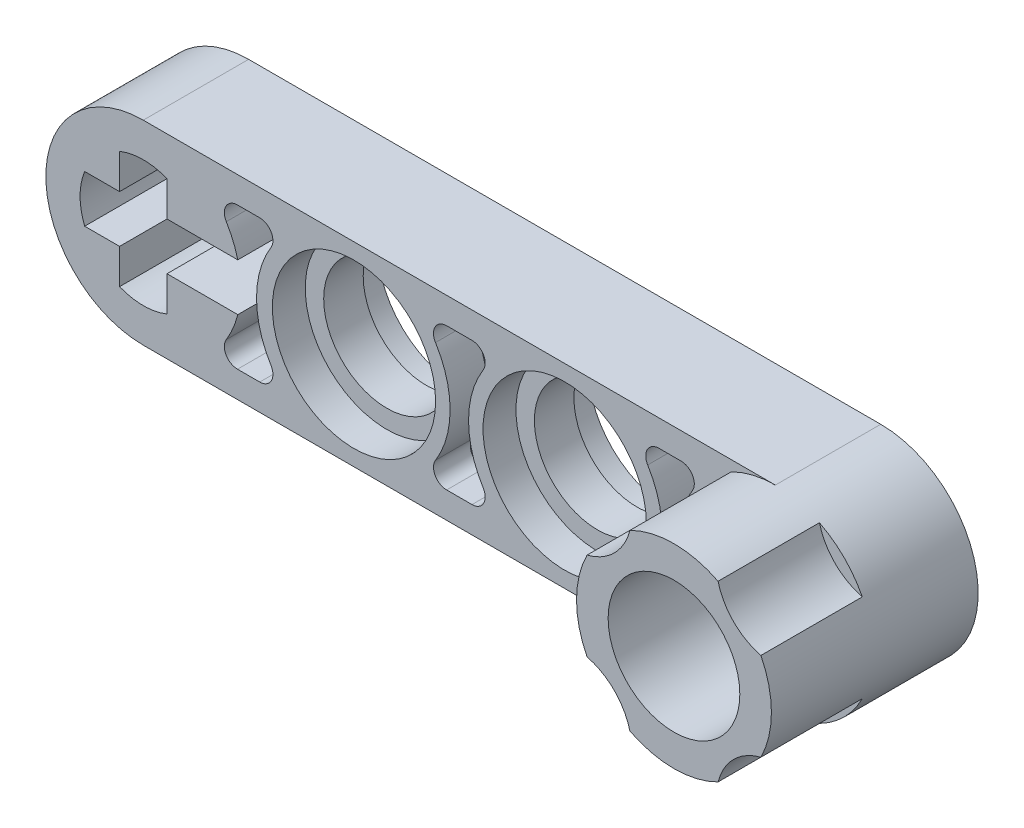
from build123d import *

# Parameters (mm, degrees)
SKETCH1_R            = 2.4
BEAM_DEPTH           = 2
AXLE_CUT_DEPTH       = 29.017494535
AXLE_CUT_DEPTH_BACK  = 29.017494535
SKETCH3_R            = 3.1
HOLE_SURROUND_DEPTH  = 1.25
CAVITY_CUT_DEPTH     = 1.4
FILLET2_R            = 0.5
FILLET2_OF_MIRROR2_R = 0.5
FILLET3_R            = 0.5
SKETCH5_R            = 2.5
EXTENSION_DEPTH      = 3.85


with BuildPart() as part:
    # Sketch1 → Beam (new, symmetric)
    with BuildSketch(Plane.XY):
        with BuildLine():
            Line((24, 3.7), (0, 3.7))
            ThreePointArc((0, 3.7), (-3.7, 0), (0, -3.7))
            Line((0, -3.7), (24, -3.7))
            ThreePointArc((24, -3.7), (27.7, 0), (24, 3.7))
        make_face()
        with Locations((8, 0)):
            Circle(SKETCH1_R, mode=Mode.SUBTRACT)
        with Locations((16, 0)):
            Circle(SKETCH1_R, mode=Mode.SUBTRACT)
    extrude(amount=BEAM_DEPTH, both=True)

    # Sketch2 → Axle Cut (cut, two sides: drawn at the far end of the back side and taken through both)
    with BuildSketch(Plane.XY.offset(-AXLE_CUT_DEPTH_BACK)):
        with BuildLine():
            ThreePointArc((-0.9, -2.224859546), (0, -2.4), (0.9, -2.224859546))
            Line((0.9, -2.224859546), (0.9, -0.9))
            Line((0.9, -0.9), (3.588871689, -0.9))
            ThreePointArc((3.588871689, -0.9), (3.188981578, -1.876271967), (2.529822128, -2.7))
            Line((2.529822128, -2.7), (5.470177872, -2.7))
            ThreePointArc((5.470177872, -2.7), (4.3, 0), (5.470177872, 2.7))
            Line((5.470177872, 2.7), (2.529822128, 2.7))
            ThreePointArc((2.529822128, 2.7), (3.188981578, 1.876271967), (3.588871689, 0.9))
            Line((3.588871689, 0.9), (0.9, 0.9))
            Line((0.9, 0.9), (0.9, 2.224859546))
            ThreePointArc((0.9, 2.224859546), (0, 2.4), (-0.9, 2.224859546))
            Line((-0.9, 2.224859546), (-0.9, 0.9))
            Line((-0.9, 0.9), (-2.224859546, 0.9))
            ThreePointArc((-2.224859546, 0.9), (-2.4, 0), (-2.224859546, -0.9))
            Line((-2.224859546, -0.9), (-0.9, -0.9))
            Line((-0.9, -0.9), (-0.9, -2.224859546))
        make_face()
        with BuildLine():
            Line((18.529822128, -2.7), (21.470177872, -2.7))
            ThreePointArc((21.470177872, -2.7), (20.811018422, -1.876271967), (20.411128311, -0.9))
            Line((20.411128311, -0.9), (23.1, -0.9))
            Line((23.1, -0.9), (23.1, -2.224859546))
            ThreePointArc((23.1, -2.224859546), (24, -2.4), (24.9, -2.224859546))
            Line((24.9, -2.224859546), (24.9, -0.9))
            Line((24.9, -0.9), (26.224859546, -0.9))
            ThreePointArc((26.224859546, -0.9), (26.4, 0), (26.224859546, 0.9))
            Line((26.224859546, 0.9), (24.9, 0.9))
            Line((24.9, 0.9), (24.9, 2.224859546))
            ThreePointArc((24.9, 2.224859546), (24, 2.4), (23.1, 2.224859546))
            Line((23.1, 2.224859546), (23.1, 0.9))
            Line((23.1, 0.9), (20.411128311, 0.9))
            ThreePointArc((20.411128311, 0.9), (20.811018422, 1.876271967), (21.470177872, 2.7))
            Line((21.470177872, 2.7), (18.529822128, 2.7))
            ThreePointArc((18.529822128, 2.7), (19.7, 0), (18.529822128, -2.7))
        make_face()
    extrude(amount=AXLE_CUT_DEPTH + AXLE_CUT_DEPTH_BACK, mode=Mode.SUBTRACT)

    # Sketch3 → Hole Surround (cut)
    with BuildSketch(Plane.XY.offset(2)):
        with Locations((16, 0)):
            Circle(SKETCH3_R)
        with Locations((8, 0)):
            Circle(SKETCH3_R)
    hole_surround = extrude(amount=-HOLE_SURROUND_DEPTH, mode=Mode.SUBTRACT)

    # Sketch4 → Cavity Cut (cut)
    with BuildSketch(Plane.XY.offset(2)):
        with BuildLine():
            Line((13.543885182, 2.7), (10.456114818, 2.7))
            ThreePointArc((10.456114818, 2.7), (11.338212028, 1.476089583), (11.65, 0))
            ThreePointArc((11.65, 0), (11.338212028, -1.476089583), (10.456114818, -2.7))
            Line((10.456114818, -2.7), (13.543885182, -2.7))
            ThreePointArc((13.543885182, -2.7), (12.35, 0), (13.543885182, 2.7))
        make_face()
    cavity_cut = extrude(amount=-CAVITY_CUT_DEPTH, mode=Mode.SUBTRACT)

    # Fillet2
    fillet2_edges = [part.edges().sort_by_distance(p)[0] for p in [
        (13.543885182, 2.7, 1.3),
        (13.543885182, -2.7, 1.3),
        (10.456114818, 2.7, 1.3),
        (10.456114818, -2.7, 1.3),
    ]]
    fillet(fillet2_edges, radius=FILLET2_R)

    # Mirror2: Hole Surround, Cavity Cut across plane
    add(hole_surround.mirror(Plane.XY), mode=Mode.SUBTRACT)
    add(cavity_cut.mirror(Plane.XY), mode=Mode.SUBTRACT)

    # Fillet2 of Mirror2
    fillet2_of_mirror2_edges = [part.edges().sort_by_distance(p)[0] for p in [
        (13.543885182, 2.7, -1.3),
        (13.543885182, -2.7, -1.3),
        (10.456114818, 2.7, -1.3),
        (10.456114818, -2.7, -1.3),
    ]]
    fillet(fillet2_of_mirror2_edges, radius=FILLET2_OF_MIRROR2_R)

    # Fillet3
    fillet3_edges = [part.edges().sort_by_distance(p)[0] for p in [
        (2.529822128, -2.7, 0),
        (5.470177872, -2.7, 0),
        (5.470177872, 2.7, 0),
        (2.529822128, 2.7, 0),
        (21.470177872, 2.7, 0),
        (21.470177872, -2.7, 0),
        (18.529822128, -2.7, 0),
        (18.529822128, 2.7, 0),
    ]]
    fillet(fillet3_edges, radius=FILLET3_R)

    # Sketch5 → Extension (add)
    with BuildSketch(Plane.XY.offset(2)):
        with BuildLine():
            ThreePointArc((27.299887499, -1.673541902), (27.7, 0), (27.299887499, 1.673541902))
            ThreePointArc((27.299887499, 1.673541902), (26.2627417, 2.2627417), (25.673541902, 3.299887499))
            ThreePointArc((25.673541902, 3.299887499), (24, 3.7), (22.326458098, 3.299887499))
            ThreePointArc((22.326458098, 3.299887499), (21.7372583, 2.2627417), (20.700112501, 1.673541902))
            ThreePointArc((20.700112501, 1.673541902), (20.3, 0), (20.700112501, -1.673541902))
            ThreePointArc((20.700112501, -1.673541902), (21.7372583, -2.2627417), (22.326458098, -3.299887499))
            ThreePointArc((22.326458098, -3.299887499), (24, -3.7), (25.673541902, -3.299887499))
            ThreePointArc((25.673541902, -3.299887499), (26.2627417, -2.2627417), (27.299887499, -1.673541902))
        make_face()
        with Locations((24, 0)):
            Circle(SKETCH5_R, mode=Mode.SUBTRACT)
    extrude(amount=EXTENSION_DEPTH)


solid = part.part
